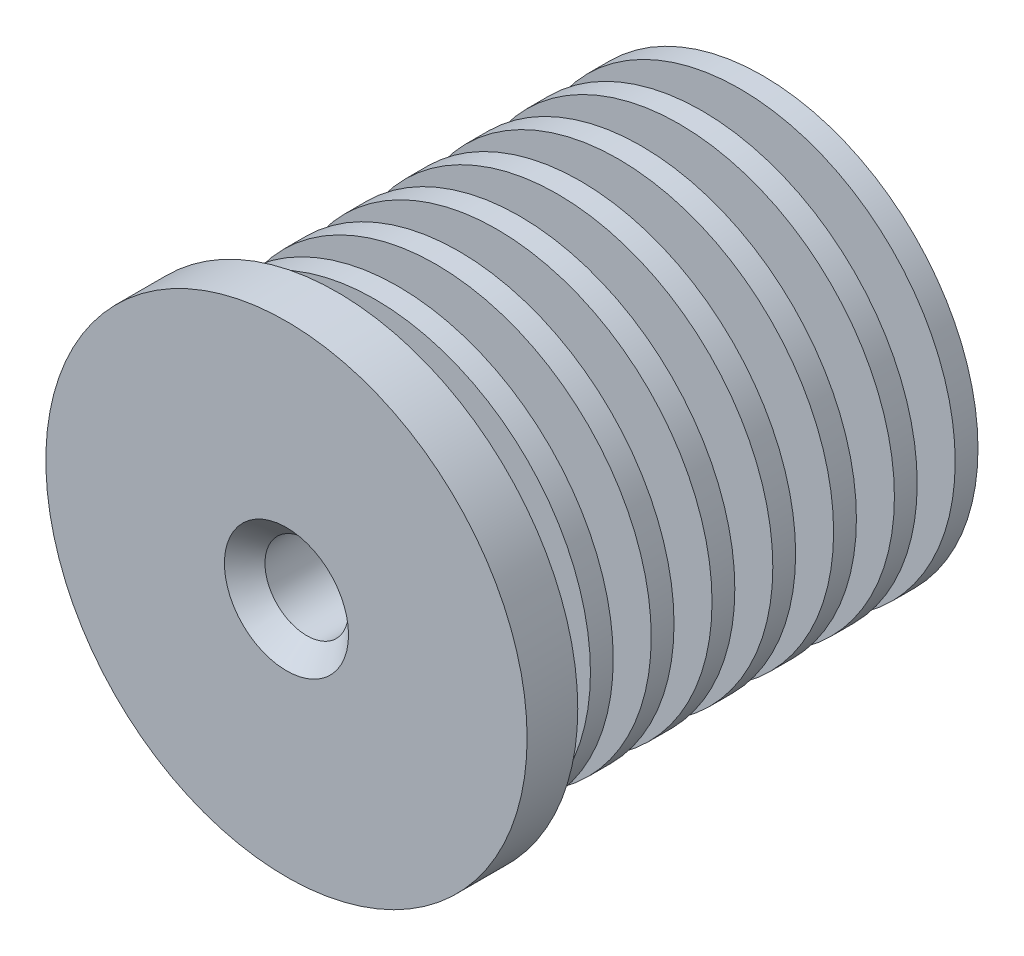
from build123d import *

# Parameters (mm, degrees)
CHAMFER1_SIZE = 0.8


with BuildPart() as part:
    # Sketch2 → Revolve1 (revolve)
    with BuildSketch(Plane(origin=(0, 0, 0), x_dir=(1, 0, 0), z_dir=(0, 1, 0))):
        Polygon((1.65, 18.8), (1.65, 0), (9.5, 0), (9.5, 2), (6, 2), (6, 3.5), (8.5, 3.5), (8.5, 4.4), (3.5, 4.4), (3.5, 5.9), (8.5, 5.9), (8.5, 6.8), (3.5, 6.8), (3.5, 8.3), (8.5, 8.3), (8.5, 9.2), (3.5, 9.2), (3.5, 10.7), (8.5, 10.7), (8.5, 11.6), (3.5, 11.6), (3.5, 13.1), (8.5, 13.1), (8.5, 14), (3.5, 14), (3.5, 15.5), (8.5, 15.5), (8.5, 16.4), (3.5, 16.4), (3.5, 17.9), (8.5, 17.9), (8.5, 18.8), align=None)
    revolve(axis=Axis((0, 0, 0), (0, 0, -1)))

    # Chamfer1
    chamfer1_edges = [part.edges().sort_by_distance(p)[0] for p in [
        (-1.65, 0, 0),
    ]]
    chamfer(chamfer1_edges, length=CHAMFER1_SIZE)

    # Sketch4 → Cut-Revolve1 (revolve, cut)
    with BuildSketch(Plane(origin=(0, 0, 0), x_dir=(1, 0, 0), z_dir=(0, 1, 0)), mode=Mode.PRIVATE) as cut_revolve1_sk:
        Polygon((0, 7.529612721), (1.65, 7.529612721), (2.1, 7.8), (2.1, 11.559655752), (2.5, 11.8), (2.5, 18.8), (0, 18.8), align=None)
    revolve(cut_revolve1_sk.sketch.rotate(Axis((0, 0, -18.8), (0, 0, 1)), 180), axis=Axis((0, 0, -18.8), (0, 0, 1)), mode=Mode.SUBTRACT)


solid = part.part
